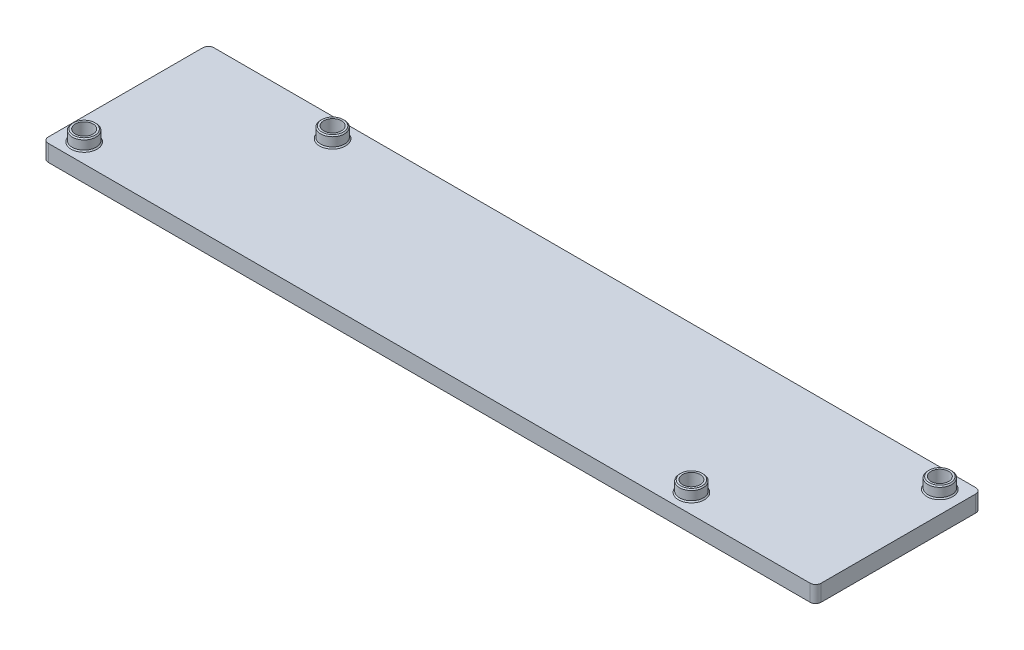
from build123d import *

# Parameters (mm, degrees)
ESQUISSE1_W        = 140
ESQUISSE1_H        = 30
ESQUISSE1_R        = 1.6
BOSS_EXTRU_1_DEPTH = 3
ESQUISSE2_R        = 2.15
ESQUISSE2_R_2      = 1.6
BOSS_EXTRU_2_DEPTH = 2
CHANFREIN1_SIZE    = 0.2
CHANFREIN2_SIZE    = 1.5
CONG_1_R           = 1


with BuildPart() as part:
    # Esquisse1 → Boss.-Extru.1 (new body)
    with BuildSketch(Plane(origin=(0, 0, 0), x_dir=(1, 0, 0), z_dir=(0, 1, 0))):
        with Locations((70, 15)):
            Rectangle(ESQUISSE1_W, ESQUISSE1_H)
        with Locations(Location((4, 3.5, 0), (0, 0, 270))):
            Circle(ESQUISSE1_R, mode=Mode.SUBTRACT)
        with Locations(Location((26, 26.5, 0), (0, 0, 270))):
            Circle(ESQUISSE1_R, mode=Mode.SUBTRACT)
        with Locations(Location((114, 3.5, 0), (0, 0, 270))):
            Circle(ESQUISSE1_R, mode=Mode.SUBTRACT)
        with Locations(Location((136, 26.5, 0), (0, 0, 270))):
            Circle(ESQUISSE1_R, mode=Mode.SUBTRACT)
    extrude(amount=BOSS_EXTRU_1_DEPTH)

    # Esquisse2 → Boss.-Extru.2 (add)
    # profile 1 of 4: a face of its own
    with BuildSketch(Plane(origin=(0, 3, 0), x_dir=(1, 0, 0), z_dir=(0, 1, 0))):
        with Locations(Location((4, 3.5, 0), (0, 0, 270))):
            Circle(ESQUISSE2_R)
        with Locations(Location((4, 3.5, 0), (0, 0, 270))):
            Circle(ESQUISSE2_R_2, mode=Mode.SUBTRACT)
    # profile 2 of 4: a face of its own
    with BuildSketch(Plane(origin=(0, 3, 0), x_dir=(1, 0, 0), z_dir=(0, 1, 0))):
        with Locations(Location((26, 26.5, 0), (0, 0, 270))):
            Circle(ESQUISSE2_R)
        with Locations(Location((26, 26.5, 0), (0, 0, 270))):
            Circle(ESQUISSE2_R_2, mode=Mode.SUBTRACT)
    # profile 3 of 4: a face of its own
    with BuildSketch(Plane(origin=(0, 3, 0), x_dir=(1, 0, 0), z_dir=(0, 1, 0))):
        with Locations(Location((114, 3.5, 0), (0, 0, 270))):
            Circle(ESQUISSE2_R)
        with Locations(Location((114, 3.5, 0), (0, 0, 270))):
            Circle(ESQUISSE2_R_2, mode=Mode.SUBTRACT)
    # profile 4 of 4: a face of its own
    with BuildSketch(Plane(origin=(0, 3, 0), x_dir=(1, 0, 0), z_dir=(0, 1, 0))):
        with Locations(Location((136, 26.5, 0), (0, 0, 270))):
            Circle(ESQUISSE2_R)
        with Locations(Location((136, 26.5, 0), (0, 0, 270))):
            Circle(ESQUISSE2_R_2, mode=Mode.SUBTRACT)
    extrude(amount=BOSS_EXTRU_2_DEPTH)

    # Chanfrein1
    chanfrein1_edges = [part.edges().sort_by_distance(p)[0] for p in [
        (4, 5, -5.65),
        (4, 3, -5.65),
        (26, 5, -28.65),
        (26, 3, -28.65),
        (114, 5, -5.65),
        (114, 3, -5.65),
        (136, 5, -28.65),
        (136, 3, -28.65),
    ]]
    chamfer(chanfrein1_edges, length=CHANFREIN1_SIZE)

    # Chanfrein2
    chanfrein2_edges = [part.edges().sort_by_distance(p)[0] for p in [
        (4, 0, -5.1),
        (26, 0, -28.1),
        (114, 0, -5.1),
        (136, 0, -28.1),
    ]]
    chamfer(chanfrein2_edges, length=CHANFREIN2_SIZE)

    # Congé1
    cong_1_edges = [part.edges().sort_by_distance(p)[0] for p in [
        (0, 1.5, -30),
        (140, 1.5, -30),
        (140, 1.5, 0),
        (0, 1.5, 0),
    ]]
    fillet(cong_1_edges, radius=CONG_1_R)


solid = part.part
